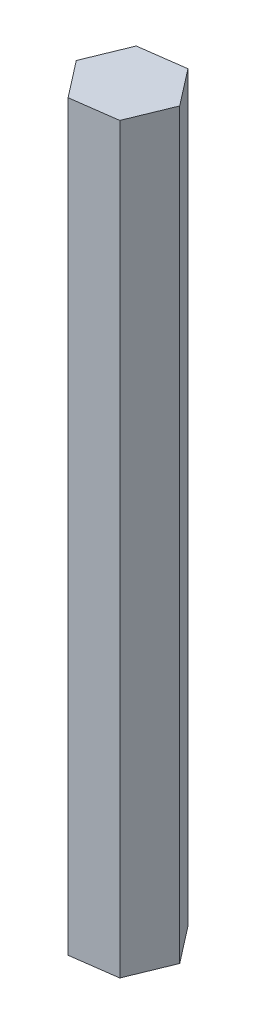
from build123d import *

# Parameters (mm, degrees)
BOSS_EXTRUDE1_DEPTH = 44.45


with BuildPart() as part:
    # Sketch1 → Boss-Extrude1 (new, symmetric)
    with BuildSketch(Plane(origin=(0, 0, 0), x_dir=(1, 0, 0), z_dir=(0, 1, 0))):
        Polygon((3.365767182, -4.348963816), (5.449196736, 0.740357975), (2.083429554, 5.089321791), (-3.365767182, 4.348963816), (-5.449196736, -0.740357975), (-2.083429554, -5.089321791), align=None)
    extrude(amount=BOSS_EXTRUDE1_DEPTH, both=True)


solid = part.part
